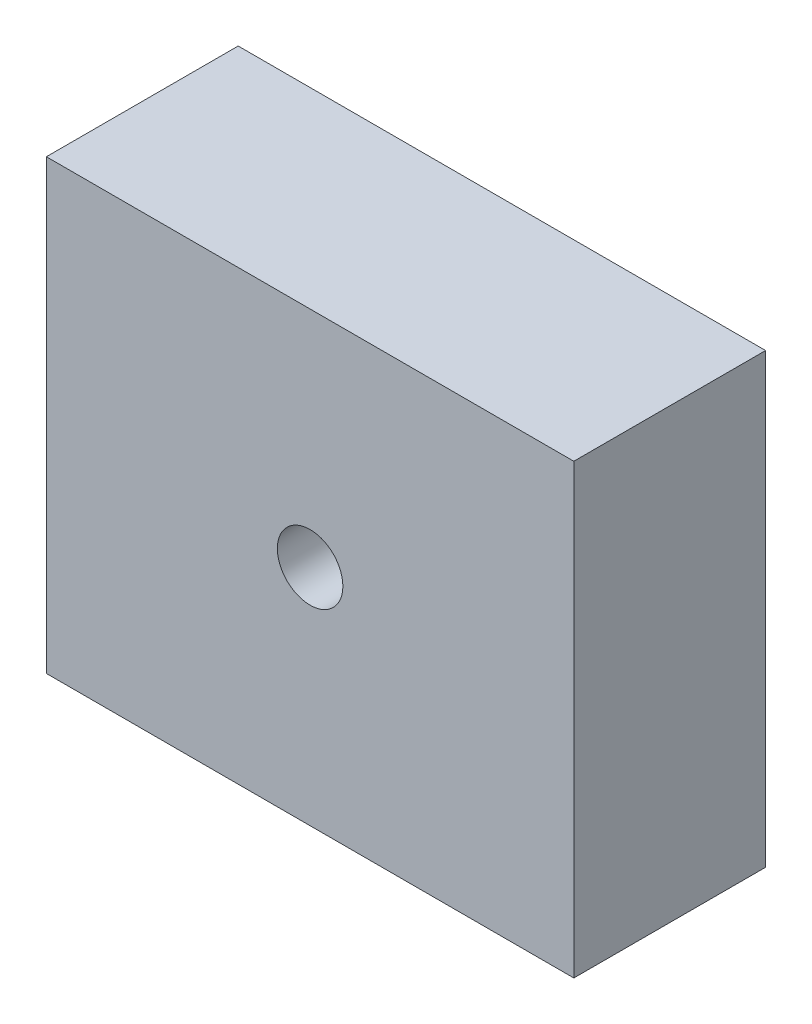
from build123d import *

# Parameters (mm, degrees)
SKETCH_1_W      = 66
SKETCH_1_H      = 56
SKETCH_1_R      = 4.1
EXTRUDE_1_DEPTH = 24


with BuildPart() as part:
    # 草图1 → 凸台-拉伸1 (new body)
    with BuildSketch(Plane.XY):
        Rectangle(SKETCH_1_W, SKETCH_1_H)
        Circle(SKETCH_1_R, mode=Mode.SUBTRACT)
    extrude(amount=EXTRUDE_1_DEPTH)


solid = part.part
